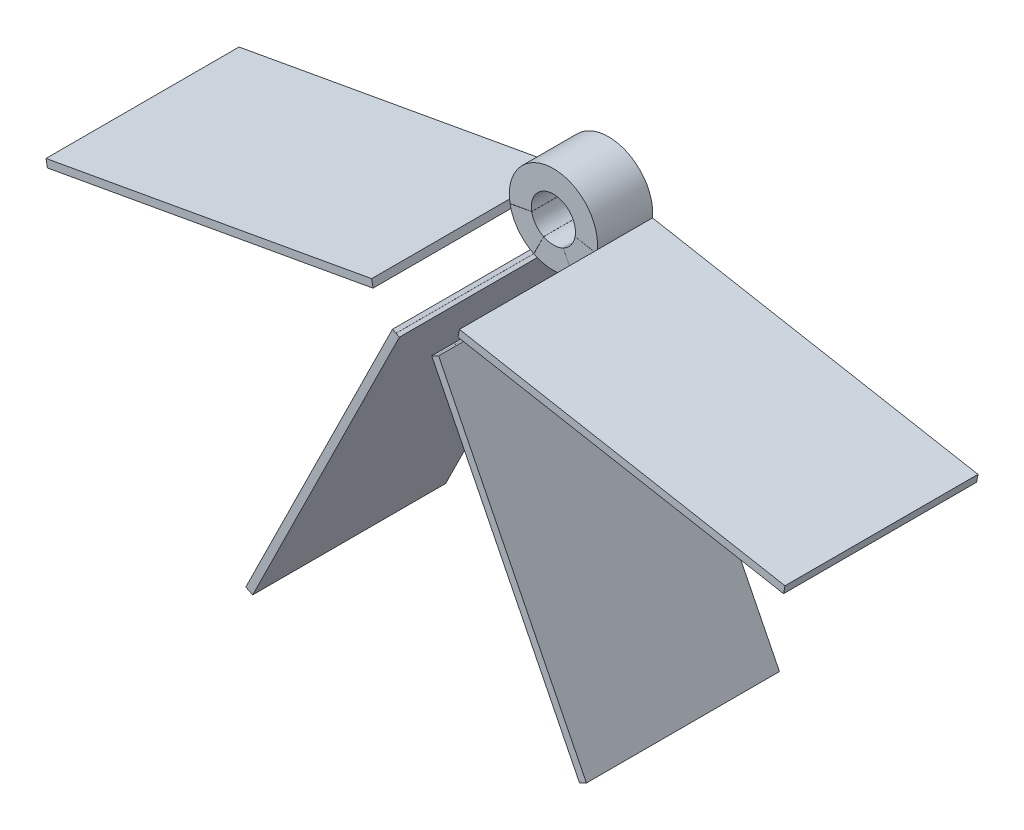
from build123d import *

# Parameters (mm, degrees)
BOSS_EXTRUDE2_DEPTH = 25
BOSS_EXTRUDE3_DEPTH = 62.5
BOSS_EXTRUDE5_DEPTH = 62.5


with BuildPart() as part:
    # Sketch1 → Boss-Extrude2 (new body)
    with BuildSketch(Plane.XY):
        with BuildLine():
            ThreePointArc((10.449971294, -17.052803287), (15.972710201, -12.036300463), (19.272609064, -5.344767522))
            Line((19.272609064, -5.344767522), (166.842934549, -32.233408918))
            Line((166.842934549, -32.233408918), (167.478249453, -28.805556447))
            Line((167.478249453, -28.805556447), (19.907923967, -1.91691505))
            ThreePointArc((19.907923967, -1.91691505), (0, 20), (-19.907923967, -1.91691505))
            Line((-19.907923967, -1.91691505), (-167.528286005, -28.529481853))
            Line((-167.528286005, -28.529481853), (-166.892971102, -31.957334324))
            Line((-166.892971102, -31.957334324), (-19.272609064, -5.344767522))
            ThreePointArc((-19.272609064, -5.344767522), (-15.972710201, -12.036300463), (-10.449971294, -17.052803287))
            Line((-10.449971294, -17.052803287), (-76.956361195, -151.503166255))
            Line((-76.956361195, -151.503166255), (-73.836414436, -153.058714328))
            Line((-73.836414436, -153.058714328), (-7.330024534, -18.60835136))
            ThreePointArc((-7.330024534, -18.60835136), (0, -20), (7.330024534, -18.60835136))
            Line((7.330024534, -18.60835136), (74.346110853, -152.805386254))
            Line((74.346110853, -152.805386254), (77.466057613, -151.249838182))
            Line((77.466057613, -151.249838182), (10.449971294, -17.052803287))
        make_face()
        with BuildLine():
            Line((9.838021699, -1.792576093), (19.676043398, -3.585152186))
            ThreePointArc((19.676043398, -3.585152186), (19.670593316, -3.614935491), (19.665098151, -3.64471051))
            Line((19.665098151, -3.64471051), (9.832549076, -1.822355255))
            ThreePointArc((9.832549076, -1.822355255), (7.988292028, -6.015578981), (4.467739088, -8.946468993))
            Line((4.467739088, -8.946468993), (8.935478176, -17.892937986))
            ThreePointArc((8.935478176, -17.892937986), (8.929717682, -17.895813536), (8.923956262, -17.898687232))
            Line((8.923956262, -17.898687232), (4.461978131, -8.949343616))
            ThreePointArc((4.461978131, -8.949343616), (0.015753498, -9.999987591), (-4.433759327, -8.963357531))
            Line((-4.433759327, -8.963357531), (-8.867518653, -17.926715062))
            ThreePointArc((-8.867518653, -17.926715062), (-8.895748496, -17.912723375), (-8.923956262, -17.898687232))
            Line((-8.923956262, -17.898687232), (-4.461978131, -8.949343616))
            ThreePointArc((-4.461978131, -8.949343616), (-7.9863551, -6.018150232), (-9.832549076, -1.822355255))
            Line((-9.832549076, -1.822355255), (-19.665098151, -3.64471051))
            ThreePointArc((-19.665098151, -3.64471051), (-19.67396555, -3.596537162), (-19.682714938, -3.54834224))
            Line((-19.682714938, -3.54834224), (-9.841357469, -1.77417112))
            ThreePointArc((-9.841357469, -1.77417112), (0.009352411, 9.999995627), (9.838021699, -1.792576093))
        make_face(mode=Mode.SUBTRACT)
    extrude(amount=BOSS_EXTRUDE2_DEPTH)

    # Sketch2 → Boss-Extrude3 (add)
    with BuildSketch(Plane.XY.offset(25)):
        Polygon((-167.528286005, -28.529481853), (-19.907923967, -1.91691505), (-19.272609064, -5.344767522), (-166.892971102, -31.957334324), align=None)
    extrude(amount=BOSS_EXTRUDE3_DEPTH)

    # Sketch3 → Boss-Extrude5 (add)
    with BuildSketch(Plane.XY.offset(25)):
        with BuildLine():
            Line((-10.449971294, -17.052803287), (-76.956361195, -151.503166255))
            Line((-76.956361195, -151.503166255), (-73.836414436, -153.058714328))
            Line((-73.836414436, -153.058714328), (-7.330024534, -18.60835136))
            Line((-7.330024534, -18.60835136), (-8.833818914, -17.85858714))
            Line((-8.833818914, -17.85858714), (-8.867518653, -17.926715062))
            ThreePointArc((-8.867518653, -17.926715062), (-8.895748496, -17.912723375), (-8.923956262, -17.898687232))
            Line((-8.923956262, -17.898687232), (-8.889997914, -17.830577323))
            Line((-8.889997914, -17.830577323), (-10.449971294, -17.052803287))
        make_face()
        with BuildLine():
            Line((8.889997914, -17.830577323), (7.330024534, -18.60835136))
            Line((7.330024534, -18.60835136), (74.346110853, -152.805386254))
            Line((74.346110853, -152.805386254), (77.466057613, -151.249838182))
            Line((77.466057613, -151.249838182), (10.449971294, -17.052803287))
            Line((10.449971294, -17.052803287), (8.901477829, -17.824853649))
            Line((8.901477829, -17.824853649), (8.935478176, -17.892937986))
            ThreePointArc((8.935478176, -17.892937986), (8.929717682, -17.895813536), (8.923956262, -17.898687232))
            Line((8.923956262, -17.898687232), (8.889997914, -17.830577323))
        make_face()
        with BuildLine():
            Line((167.478249453, -28.805556447), (19.907923967, -1.91691505))
            Line((19.907923967, -1.91691505), (19.60125996, -3.571525971))
            Line((19.60125996, -3.571525971), (19.676043398, -3.585152186))
            ThreePointArc((19.676043398, -3.585152186), (19.670593316, -3.614935491), (19.665098151, -3.64471051))
            Line((19.665098151, -3.64471051), (19.590266516, -3.630841286))
            Line((19.590266516, -3.630841286), (19.272609064, -5.344767522))
            Line((19.272609064, -5.344767522), (166.842934549, -32.233408918))
            Line((166.842934549, -32.233408918), (167.478249453, -28.805556447))
        make_face()
    extrude(amount=BOSS_EXTRUDE5_DEPTH)


solid = part.part
